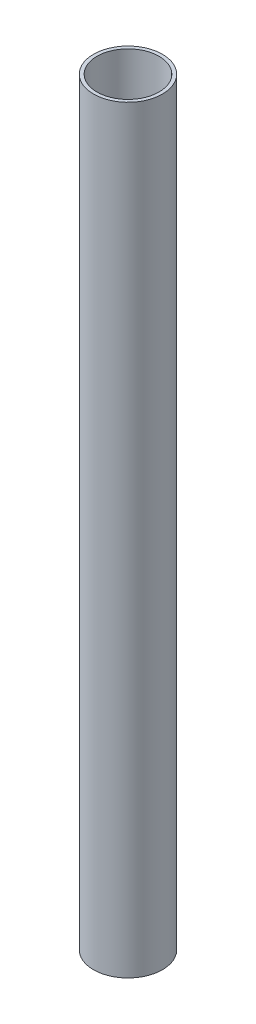
from build123d import *

# Parameters (mm, degrees)
SKETCH_1_R   = 10
SKETCH_1_R_2 = 9
F_1MM_DEPTH  = 110


with BuildPart() as part:
    # 草图1 → 1mm (new, symmetric)
    with BuildSketch(Plane(origin=(0, 0, 0), x_dir=(1, 0, 0), z_dir=(0, 1, 0))):
        Circle(SKETCH_1_R)
        Circle(SKETCH_1_R_2, mode=Mode.SUBTRACT)
    extrude(amount=F_1MM_DEPTH, both=True)


solid = part.part
